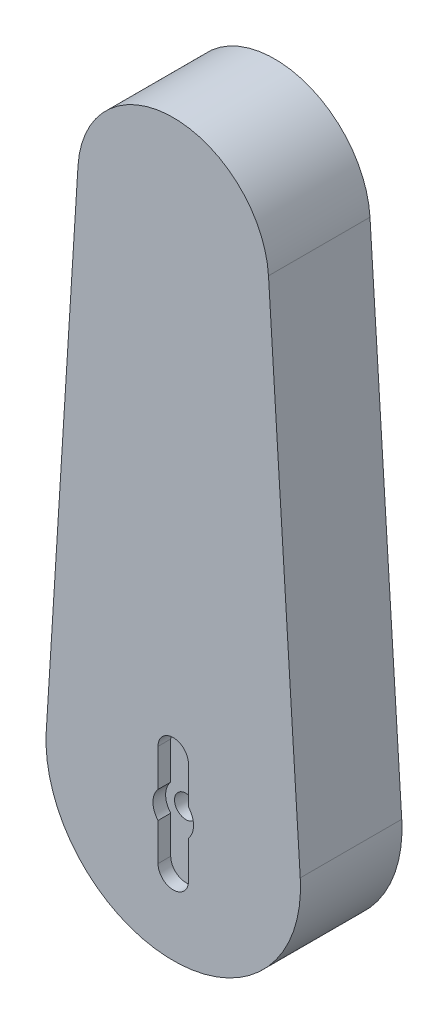
from build123d import *

# Parameters (mm, degrees)
BOSS_EXTRUDE1_DEPTH = 20
CUT_EXTRUDE1_DEPTH  = 2.5
SKETCH4_R           = 2.25
CUT_EXTRUDE2_DEPTH  = 10
SKETCH5_W           = 12.8
SKETCH5_H           = 23.5
CUT_EXTRUDE3_DEPTH  = 16
SKETCH6_R           = 1
CUT_EXTRUDE4_DEPTH  = 6


with BuildPart() as part:
    # Sketch2 → Boss-Extrude1 (new body)
    with BuildSketch(Plane.XY):
        with BuildLine():
            Line((18.766775804, 101.178603266), (25.022367739, 1.571471021))
            ThreePointArc((25.022367739, 1.571471021), (0, -25.07166545), (-25.022367739, 1.571471021))
            Line((-25.022367739, 1.571471021), (-18.766775804, 101.178603266))
            ThreePointArc((-18.766775804, 101.178603266), (0, 118.803749087), (18.766775804, 101.178603266))
        make_face()
    extrude(amount=BOSS_EXTRUDE1_DEPTH)

    # Sketch3 → Cut-Extrude1 (cut)
    with BuildSketch(Plane.XY.offset(20)):
        with BuildLine():
            Line((-3, -10), (-3, -2.645751311))
            ThreePointArc((-3, -2.645751311), (-4, 0), (-3, 2.645751311))
            Line((-3, 2.645751311), (-3, 10))
            ThreePointArc((-3, 10), (0, 13), (3, 10))
            Line((3, 10), (3, 2.645751311))
            ThreePointArc((3, 2.645751311), (4, 0), (3, -2.645751311))
            Line((3, -2.645751311), (3, -10))
            ThreePointArc((3, -10), (0, -13), (-3, -10))
        make_face()
    extrude(amount=-CUT_EXTRUDE1_DEPTH, mode=Mode.SUBTRACT)

    # Sketch4 → Cut-Extrude2 (cut)
    with BuildSketch(Plane.XY.offset(17.5)):
        Circle(SKETCH4_R)
    extrude(amount=-CUT_EXTRUDE2_DEPTH, mode=Mode.SUBTRACT)

    # Sketch5 → Cut-Extrude3 (cut)
    with BuildSketch(Plane(origin=(0, 0, 0), x_dir=(-1, 0, 0), z_dir=(0, 0, -1))):
        with Locations((0, 94.25)):
            Rectangle(SKETCH5_W, SKETCH5_H)
    extrude(amount=-CUT_EXTRUDE3_DEPTH, mode=Mode.SUBTRACT)

    # Sketch6 → Cut-Extrude4 (cut)
    with BuildSketch(Plane(origin=(0, 0, 0), x_dir=(-1, 0, 0), z_dir=(0, 0, -1))):
        with Locations((0, 108.6)):
            Circle(SKETCH6_R)
        with Locations((0, 79.9)):
            Circle(SKETCH6_R)
    extrude(amount=-CUT_EXTRUDE4_DEPTH, mode=Mode.SUBTRACT)


solid = part.part
